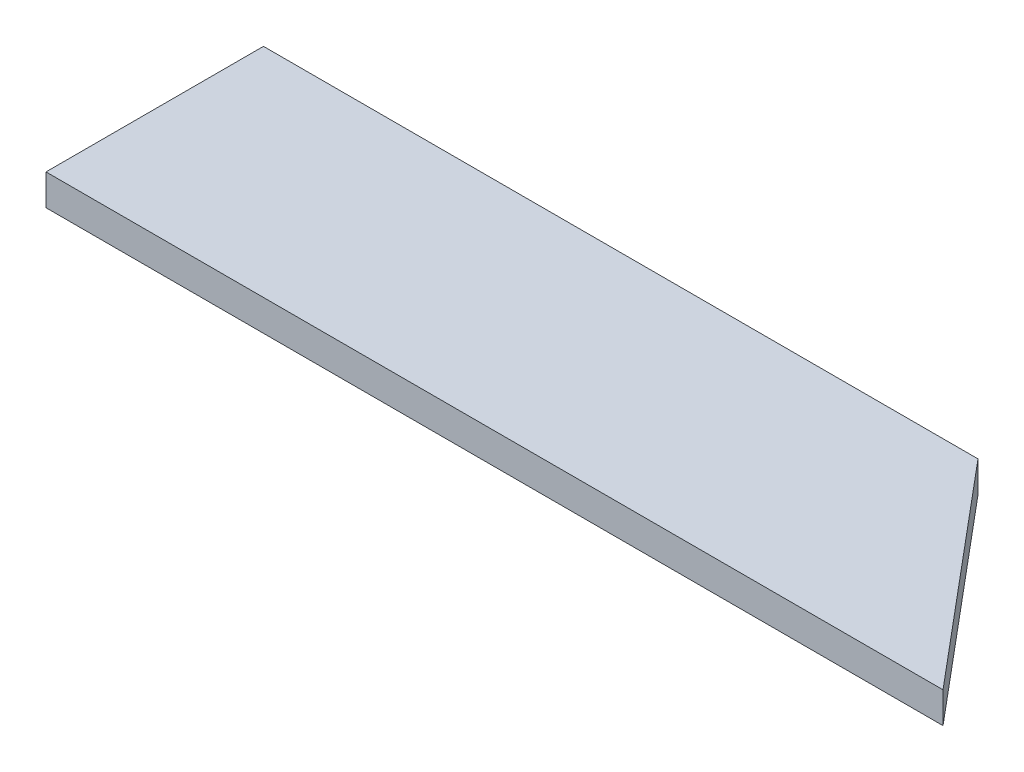
from build123d import *

# Parameters (mm, degrees)
BOSS_EXTRUDE1_DEPTH = 10


with BuildPart() as part:
    # Sketch1 → Boss-Extrude1 (new body)
    with BuildSketch(Plane(origin=(0, 0, 0), x_dir=(1, 0, 0), z_dir=(0, 1, 0))):
        Polygon((115, 35), (173.736974182, -35), (115, -35), (-115, -35), (-115, 35), align=None)
    extrude(amount=BOSS_EXTRUDE1_DEPTH)


solid = part.part
